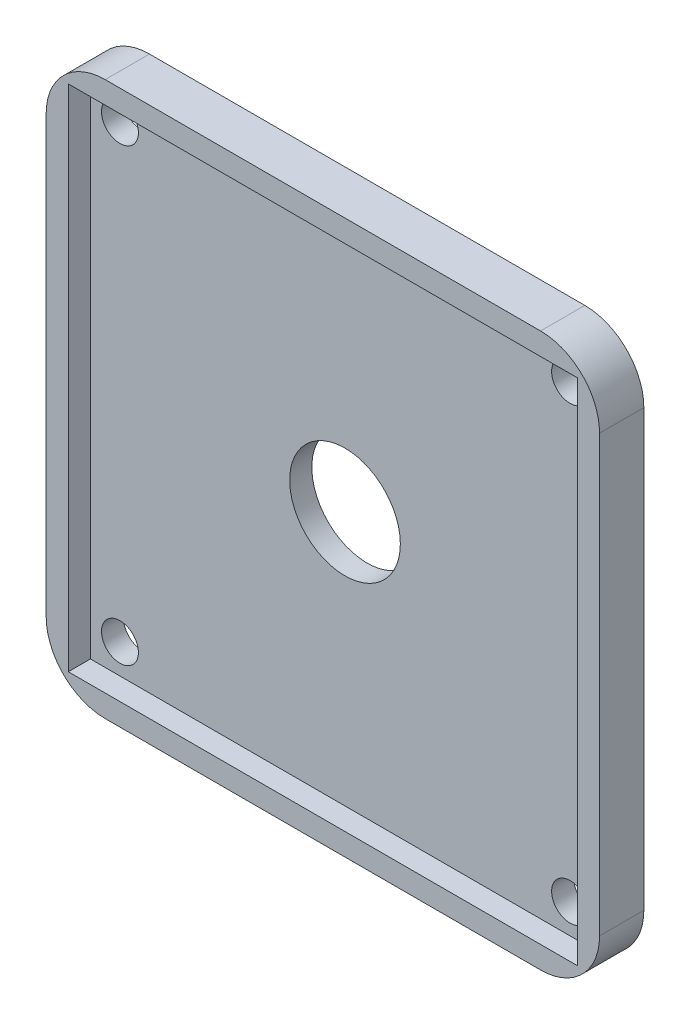
from build123d import *

# Parameters (mm, degrees)
SKETCH1_W           = 75
SKETCH1_H           = 75
SKETCH1_R           = 2.5
SKETCH1_R_2         = 7.5
BOSS_EXTRUDE1_DEPTH = 6
SKETCH2_W           = 69
SKETCH2_H           = 69
CUT_EXTRUDE1_DEPTH  = 3
FILLET1_R           = 8


with BuildPart() as part:
    # Sketch1 → Boss-Extrude1 (new body)
    with BuildSketch(Plane.XY):
        with Locations((37.5, 37.5)):
            Rectangle(SKETCH1_W, SKETCH1_H)
        with Locations((7, 68)):
            Circle(SKETCH1_R, mode=Mode.SUBTRACT)
        with Locations(Location((68, 68, 0), (0, 0, 180))):
            Circle(SKETCH1_R, mode=Mode.SUBTRACT)
        with Locations((68, 7)):
            Circle(SKETCH1_R, mode=Mode.SUBTRACT)
        with Locations(Location((7, 7, 0), (0, 0, 180))):
            Circle(SKETCH1_R, mode=Mode.SUBTRACT)
        with Locations((37.5, 37.5)):
            Circle(SKETCH1_R_2, mode=Mode.SUBTRACT)
    extrude(amount=BOSS_EXTRUDE1_DEPTH)

    # Sketch2 → Cut-Extrude1 (cut)
    with BuildSketch(Plane.XY.offset(6)):
        with Locations((37.5, 37.5)):
            Rectangle(SKETCH2_W, SKETCH2_H)
    extrude(amount=-CUT_EXTRUDE1_DEPTH, mode=Mode.SUBTRACT)

    # Fillet1
    fillet1_edges = [part.edges().sort_by_distance(p)[0] for p in [
        (0, 75, 3),
        (75, 75, 3),
        (75, 0, 3),
        (0, 0, 3),
    ]]
    fillet(fillet1_edges, radius=FILLET1_R)


solid = part.part
